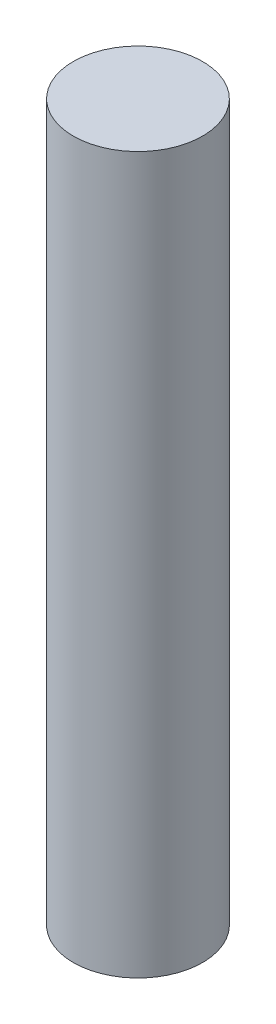
from build123d import *

# Parameters (mm, degrees)
SKETCH_1_R      = 1.4
EXTRUDE_1_DEPTH = 15.5


with BuildPart() as part:
    # 草图1 → 凸台-拉伸1 (new body)
    with BuildSketch(Plane(origin=(0, 0, 0), x_dir=(1, 0, 0), z_dir=(0, 1, 0))):
        with Locations(Location((0, 0, 0), (0, 0, 270))):
            Circle(SKETCH_1_R)
    extrude(amount=EXTRUDE_1_DEPTH)


solid = part.part
